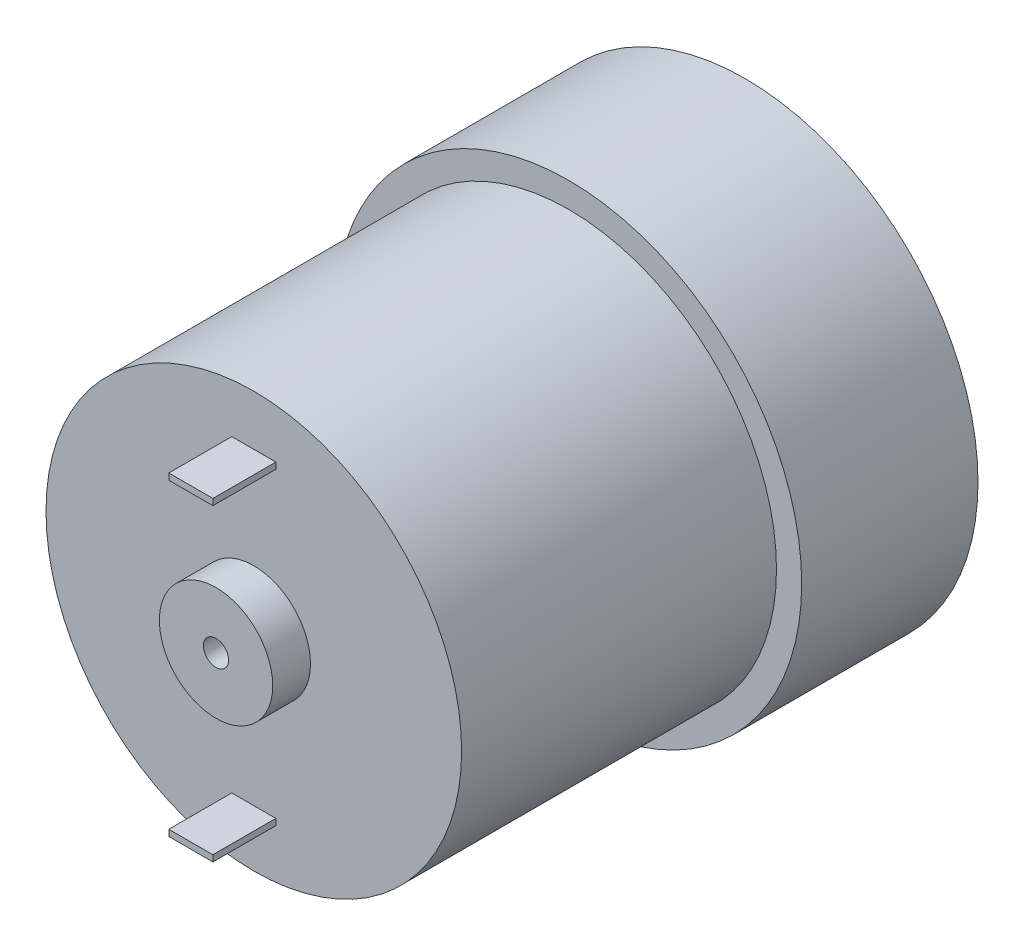
from build123d import *

# Parameters (mm, degrees)
SKETCH1_R                 = 18.5
BOSS_EXTRUDE1_DEPTH       = 42
CUT_EXTRUDE1_START        = -3
SKETCH2_R                 = 18.5
SKETCH2_R_2               = 4.5
CUT_EXTRUDE1_DEPTH        = 3
CUT_EXTRUDE4_START        = -25
SKETCH3_R                 = 18.5
SKETCH3_R_2               = 16.5
CUT_EXTRUDE4_DEPTH        = 25
SKETCH4_R                 = 6
BOSS_EXTRUDE2_DEPTH       = 4.6
FILLET1_R                 = 0.5
SKETCH5_R                 = 3
CUT_EXTRUDE5_DEPTH        = 10
SKETCH6_R                 = 1
CUT_EXTRUDE6_DEPTH        = 10
SKETCH7_W                 = 3.5
SKETCH7_H                 = 0.5
BOSS_EXTRUDE3_DEPTH       = 5
M3X0_5_TAPPED_HOLE1_D     = 2.5
M3X0_5_TAPPED_HOLE1_DEPTH = 7.5
M3X0_5_TAPPED_HOLE1_TIP   = 0.751075774
F_3_0MM_DOWEL_HOLE1_D     = 3
F_3_0MM_DOWEL_HOLE1_DEPTH = 7.5
F_3_0MM_DOWEL_HOLE1_TIP   = 0.901290929


with BuildPart() as part:
    # Sketch1 → Boss-Extrude1 (new body)
    with BuildSketch(Plane.XY):
        with Locations(Location((0, 0, 0), (0, 0, 180))):
            Circle(SKETCH1_R)
    extrude(amount=BOSS_EXTRUDE1_DEPTH)

    # Sketch2 → Cut-Extrude1 (cut)
    with BuildSketch(Plane.XY.offset(42).offset(CUT_EXTRUDE1_START)):
        with Locations(Location((0, 0, 0), (0, 0, 180))):
            Circle(SKETCH2_R)
        Circle(SKETCH2_R_2, mode=Mode.SUBTRACT)
    extrude(amount=CUT_EXTRUDE1_DEPTH, mode=Mode.SUBTRACT)

    # Sketch3 → Cut-Extrude4 (cut)
    with BuildSketch(Plane.XY.offset(39).offset(CUT_EXTRUDE4_START)):
        with Locations(Location((0, 0, 0), (0, 0, 180))):
            Circle(SKETCH3_R)
        Circle(SKETCH3_R_2, mode=Mode.SUBTRACT)
    extrude(amount=CUT_EXTRUDE4_DEPTH, mode=Mode.SUBTRACT)

    # Sketch4 → Boss-Extrude2 (add)
    with BuildSketch(Plane(origin=(0, 0, 0), x_dir=(-1, 0, 0), z_dir=(0, 0, -1))):
        with Locations(Location((0, -7, 0), (0, 0, 180))):
            Circle(SKETCH4_R)
    extrude(amount=BOSS_EXTRUDE2_DEPTH)

    # Fillet1
    fillet1_edges = [part.edges().sort_by_distance(p)[0] for p in [
        (-6, -7, -4.6),
    ]]
    fillet(fillet1_edges, radius=FILLET1_R)

    # Sketch5 → Cut-Extrude5 (cut)
    with BuildSketch(Plane(origin=(0, 0, -4.6), x_dir=(-1, 0, 0), z_dir=(0, 0, -1))):
        with Locations((0, -7)):
            Circle(SKETCH5_R)
    extrude(amount=-CUT_EXTRUDE5_DEPTH, mode=Mode.SUBTRACT)

    # Sketch6 → Cut-Extrude6 (cut)
    with BuildSketch(Plane.XY.offset(42)):
        Circle(SKETCH6_R)
    extrude(amount=-CUT_EXTRUDE6_DEPTH, mode=Mode.SUBTRACT)

    # Sketch7 → Boss-Extrude3 (add)
    with BuildSketch(Plane.XY.offset(39)):
        with Locations((0, 12.25)):
            Rectangle(SKETCH7_W, SKETCH7_H)
        with Locations((0, -12.25)):
            Rectangle(SKETCH7_W, SKETCH7_H)
    extrude(amount=BOSS_EXTRUDE3_DEPTH)

    # M3x0.5 Tapped Hole1
    with Locations(Plane(origin=(0, 0, 0), x_dir=(-1, 0, 0), z_dir=(0, 0, -1))):
        with Locations((15.5, 0), (-7.75, 13.423393759), (-7.75, -13.423393759), (-15.5, 0)):
            Hole(M3X0_5_TAPPED_HOLE1_D / 2, depth=M3X0_5_TAPPED_HOLE1_DEPTH)
            with Locations((0, 0, -(M3X0_5_TAPPED_HOLE1_DEPTH + M3X0_5_TAPPED_HOLE1_TIP / 2))):  # 118° drill point
                Cone(0, M3X0_5_TAPPED_HOLE1_D / 2, M3X0_5_TAPPED_HOLE1_TIP, mode=Mode.SUBTRACT)

    # Ø3.0mm Dowel Hole1
    with Locations(Plane(origin=(0, 0, 0), x_dir=(-1, 0, 0), z_dir=(0, 0, -1))):
        with Locations((0, 15.5), (-13.829316686, -7), (13.829316686, -7)):
            Hole(F_3_0MM_DOWEL_HOLE1_D / 2, depth=F_3_0MM_DOWEL_HOLE1_DEPTH)
            with Locations((0, 0, -(F_3_0MM_DOWEL_HOLE1_DEPTH + F_3_0MM_DOWEL_HOLE1_TIP / 2))):  # 118° drill point
                Cone(0, F_3_0MM_DOWEL_HOLE1_D / 2, F_3_0MM_DOWEL_HOLE1_TIP, mode=Mode.SUBTRACT)


solid = part.part
